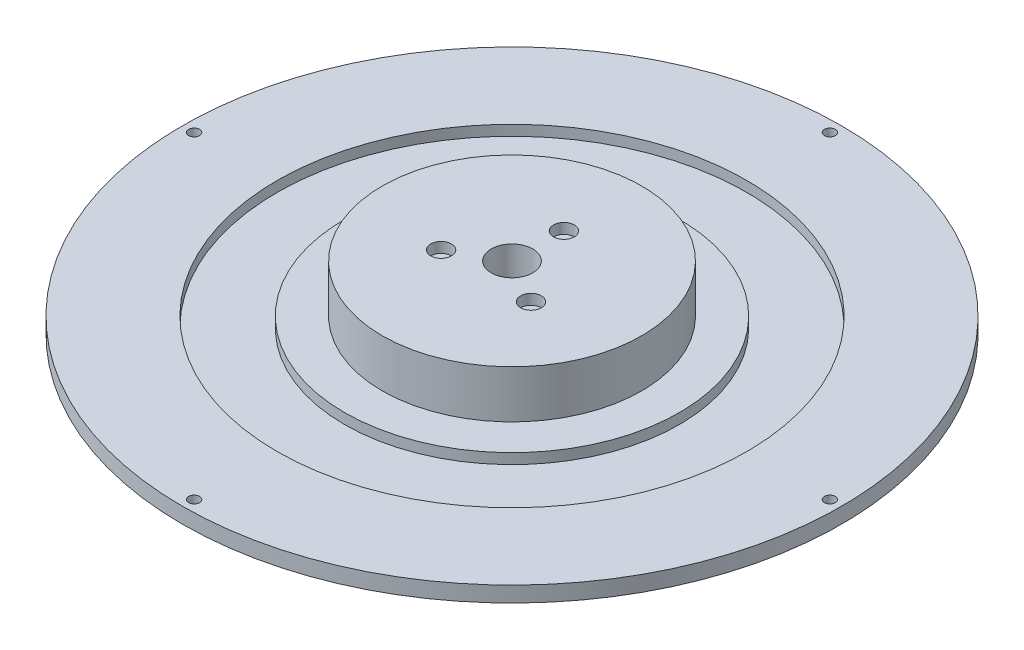
from build123d import *

# Parameters (mm, degrees)
SKETCH1_R           = 63.5
SKETCH1_R_2         = 1.05
BOSS_EXTRUDE1_DEPTH = 3
SKETCH2_R           = 45.25
SKETCH2_R_2         = 32.25
CUT_EXTRUDE1_DEPTH  = 2
SKETCH4_R           = 25
BOSS_EXTRUDE2_DEPTH = 9.2
SKETCH5_R           = 2
CUT_EXTRUDE2_DEPTH  = 2
SKETCH6_R           = 4
CUT_EXTRUDE3_DEPTH  = 91.627479276


with BuildPart() as part:
    # Sketch1 → Boss-Extrude1 (new body)
    with BuildSketch(Plane(origin=(0, 0, 0), x_dir=(1, 0, 0), z_dir=(0, 1, 0))):
        with Locations(Location((0, 0, 0), (0, 0, 270))):
            Circle(SKETCH1_R)
        with Locations(Location((0, 61.25, 0), (0, 0, 270))):
            Circle(SKETCH1_R_2, mode=Mode.SUBTRACT)
        with Locations(Location((61.25, 0, 0), (0, 0, 270))):
            Circle(SKETCH1_R_2, mode=Mode.SUBTRACT)
        with Locations(Location((0, -61.25, 0), (0, 0, 270))):
            Circle(SKETCH1_R_2, mode=Mode.SUBTRACT)
        with Locations(Location((-61.25, 0, 0), (0, 0, 270))):
            Circle(SKETCH1_R_2, mode=Mode.SUBTRACT)
    extrude(amount=BOSS_EXTRUDE1_DEPTH)

    # Sketch2 → Cut-Extrude1 (cut)
    with BuildSketch(Plane(origin=(0, 3, 0), x_dir=(1, 0, 0), z_dir=(0, 1, 0))):
        with Locations(Location((0, 0, 0), (0, 0, 270))):
            Circle(SKETCH2_R)
        with Locations(Location((0, 0, 0), (0, 0, 270))):
            Circle(SKETCH2_R_2, mode=Mode.SUBTRACT)
    extrude(amount=-CUT_EXTRUDE1_DEPTH, mode=Mode.SUBTRACT)

    # Sketch4 → Boss-Extrude2 (add)
    with BuildSketch(Plane(origin=(0, 3, 0), x_dir=(1, 0, 0), z_dir=(0, 1, 0))):
        with Locations(Location((0, 0, 0), (0, 0, 270))):
            Circle(SKETCH4_R)
    extrude(amount=BOSS_EXTRUDE2_DEPTH)

    # Sketch5 → Cut-Extrude2 (cut)
    with BuildSketch(Plane(origin=(0, 12.2, 0), x_dir=(1, 0, 0), z_dir=(0, 1, 0))):
        with Locations(Location((0, 10, 0), (0, 0, 270))):
            Circle(SKETCH5_R)
        with Locations(Location((8.660254038, -5, 0), (0, 0, 270))):
            Circle(SKETCH5_R)
        with Locations(Location((-8.660254038, -5, 0), (0, 0, 270))):
            Circle(SKETCH5_R)
    extrude(amount=-CUT_EXTRUDE2_DEPTH, mode=Mode.SUBTRACT)

    # Sketch6 → Cut-Extrude3 (cut, through all)
    with BuildSketch(Plane(origin=(0, 12.2, 0), x_dir=(1, 0, 0), z_dir=(0, 1, 0))):
        with Locations(Location((0, 0, 0), (0, 0, 270))):
            Circle(SKETCH6_R)
    extrude(amount=-CUT_EXTRUDE3_DEPTH, mode=Mode.SUBTRACT)


solid = part.part
